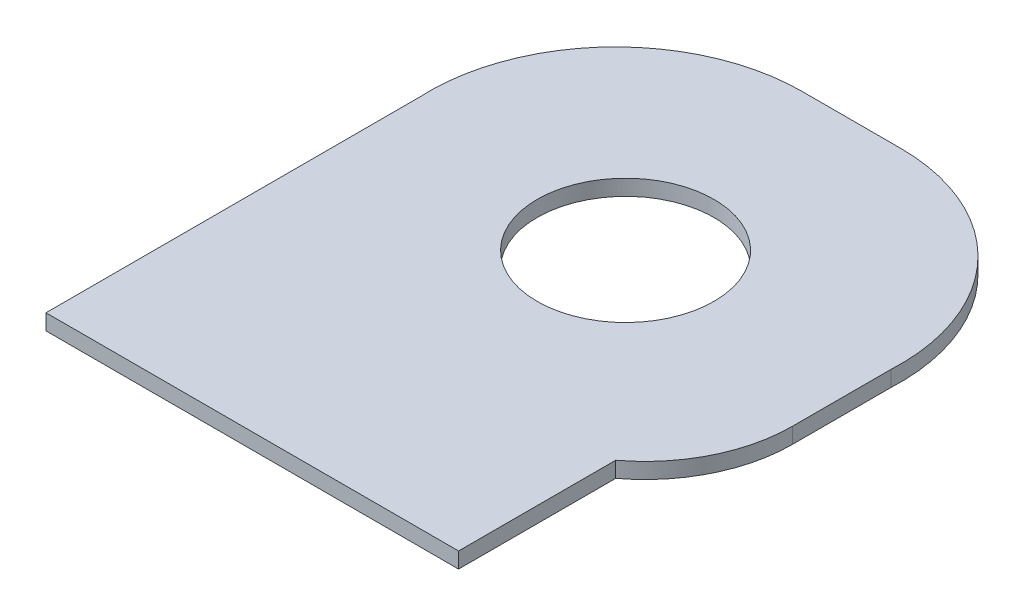
from build123d import *

# Parameters (mm, degrees)
ESQUISSE1_R      = 9
EXTRUSION1_DEPTH = 1.6


with BuildPart() as part:
    # Esquisse1 → Extrusion1 (new body)
    with BuildSketch(Plane(origin=(0, 0, 0), x_dir=(1, 0, 0), z_dir=(0, 1, 0))):
        with BuildLine():
            Line((-24, 9), (-24, -29))
            Line((-24, -29), (18, -29))
            Line((18, -29), (18, -13))
            ThreePointArc((18, -13), (22.416407865, -7.708203932), (24, -1))
            Line((24, -1), (24, 9))
            ThreePointArc((24, 9), (18.793114224, 23.078458513), (5, 29))
            Line((5, 29), (-5, 29))
            ThreePointArc((-5, 29), (-18.793114224, 23.078458513), (-24, 9))
        make_face()
        with Locations(Location((0, 6, 0), (0, 0, 270))):
            Circle(ESQUISSE1_R, mode=Mode.SUBTRACT)
    extrude(amount=EXTRUSION1_DEPTH)


solid = part.part
